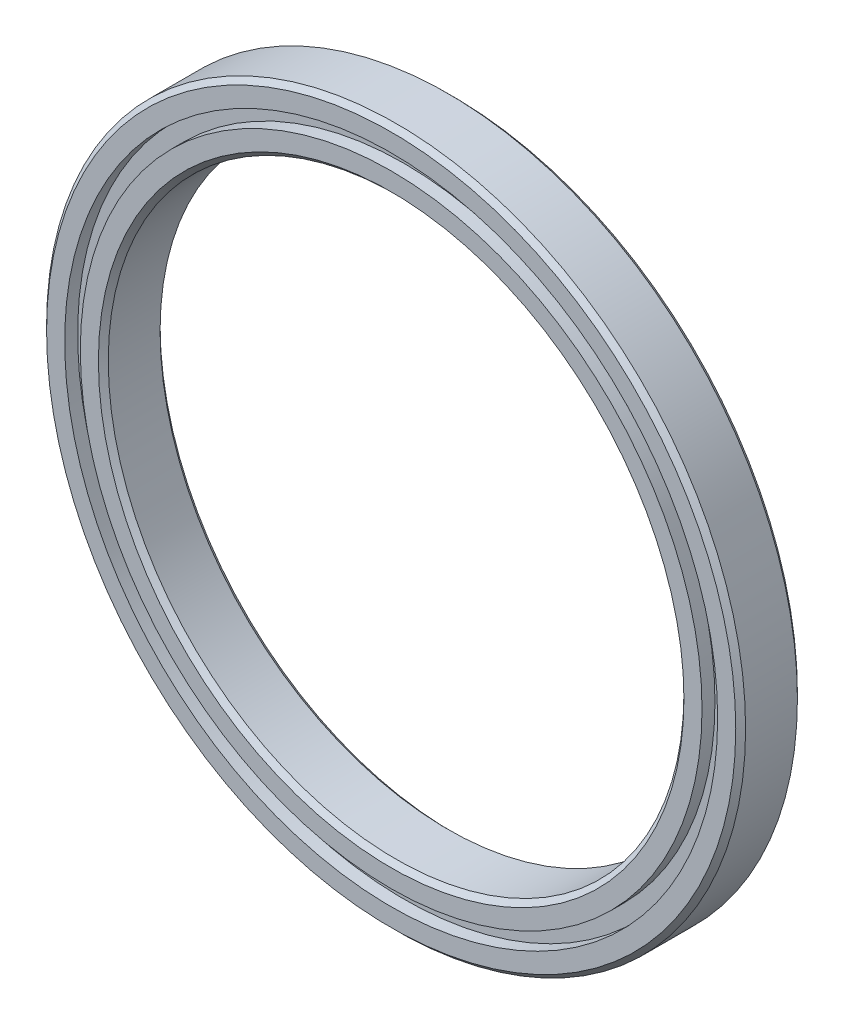
from build123d import *

# Parameters (mm, degrees)
SKETCH1_R          = 26.9875
SKETCH1_R_2        = 22.225
EXTRUDE1_DEPTH     = 4.7625
SKETCH2_R          = 25.2095
SKETCH2_R_2        = 24.003
CUT_EXTRUDE1_DEPTH = 1
CUT_EXTRUDE2_START = -1
SKETCH3_R          = 25.2095
SKETCH3_R_2        = 24.003
CUT_EXTRUDE2_DEPTH = 1
CHAMFER1_SIZE      = 0.381


with BuildPart() as part:
    # Sketch1 → Extrude1 (new body)
    with BuildSketch(Plane.XY):
        with Locations(Location((-4.538848476, -45.531959332, 0), (0, 0, 180))):
            Circle(SKETCH1_R)
        with Locations(Location((-4.538848476, -45.531959332, 0), (0, 0, 180))):
            Circle(SKETCH1_R_2, mode=Mode.SUBTRACT)
    extrude(amount=EXTRUDE1_DEPTH)

    # Sketch2 → Cut-Extrude1 (cut)
    with BuildSketch(Plane.XY.offset(4.7625)):
        with Locations((-4.538848476, -45.531959332)):
            Circle(SKETCH2_R)
        with Locations((-4.538848476, -45.531959332)):
            Circle(SKETCH2_R_2, mode=Mode.SUBTRACT)
    extrude(amount=-CUT_EXTRUDE1_DEPTH, mode=Mode.SUBTRACT)

    # Sketch3 → Cut-Extrude2 (cut)
    with BuildSketch(Plane(origin=(0, 0, 0), x_dir=(-1, 0, 0), z_dir=(0, 0, -1)).offset(CUT_EXTRUDE2_START)):
        with Locations(Location((4.538848476, -45.531959332, 0), (0, 0, 180))):
            Circle(SKETCH3_R)
        with Locations(Location((4.538848476, -45.531959332, 0), (0, 0, 180))):
            Circle(SKETCH3_R_2, mode=Mode.SUBTRACT)
    extrude(amount=CUT_EXTRUDE2_DEPTH, mode=Mode.SUBTRACT)

    # Chamfer1
    chamfer1_edges = [part.edges().sort_by_distance(p)[0] for p in [
        (22.448651524, -45.531959332, 0),
        (22.448651524, -45.531959332, 4.7625),
        (17.686151524, -45.531959332, 0),
        (17.686151524, -45.531959332, 4.7625),
    ]]
    chamfer(chamfer1_edges, length=CHAMFER1_SIZE)


solid = part.part
